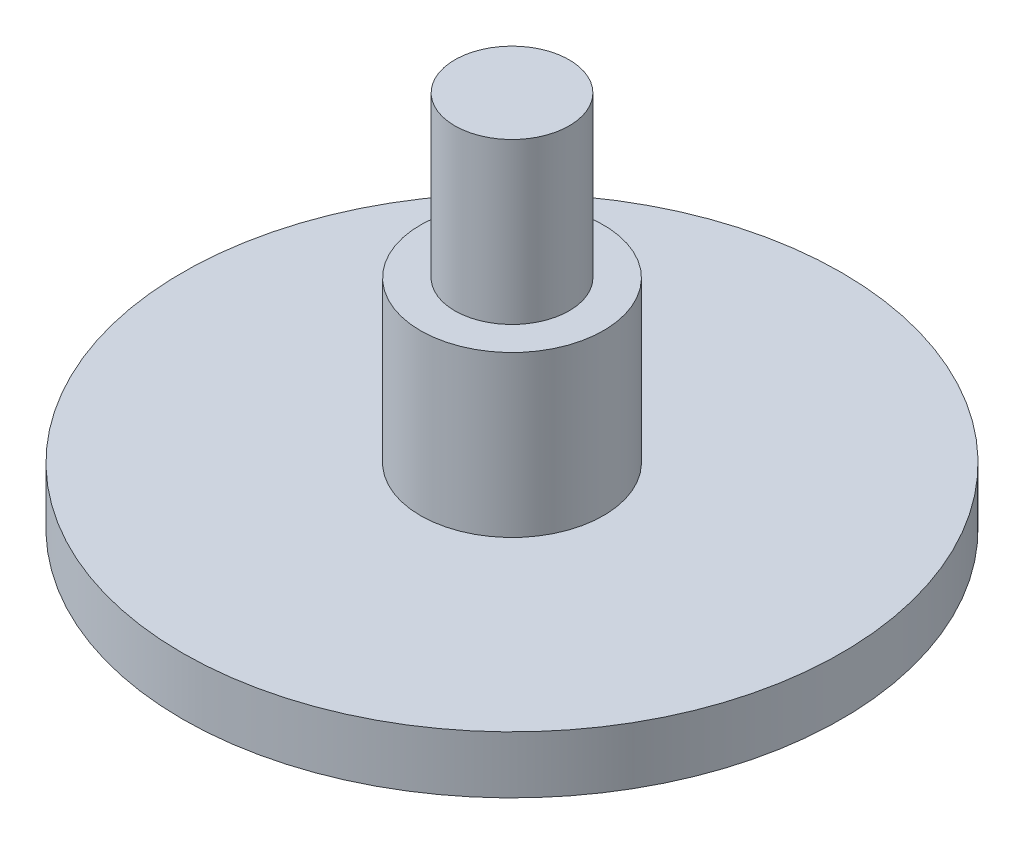
from build123d import *

# Parameters (mm, degrees)
SKETCH1_R           = 28.8
BOSS_EXTRUDE1_DEPTH = 5
SKETCH2_R           = 8
BOSS_EXTRUDE2_DEPTH = 14
SKETCH3_R           = 5
BOSS_EXTRUDE3_DEPTH = 14


with BuildPart() as part:
    # Sketch1 → Boss-Extrude1 (new body)
    with BuildSketch(Plane(origin=(0, 0, 0), x_dir=(1, 0, 0), z_dir=(0, 1, 0))):
        with Locations(Location((0, 0, 0), (0, 0, 270))):
            Circle(SKETCH1_R)
    extrude(amount=BOSS_EXTRUDE1_DEPTH)

    # Sketch2 → Boss-Extrude2 (add)
    with BuildSketch(Plane(origin=(0, 5, 0), x_dir=(1, 0, 0), z_dir=(0, 1, 0))):
        with Locations(Location((0, 0, 0), (0, 0, 270))):
            Circle(SKETCH2_R)
    extrude(amount=BOSS_EXTRUDE2_DEPTH)

    # Sketch3 → Boss-Extrude3 (add)
    with BuildSketch(Plane(origin=(0, 19, 0), x_dir=(1, 0, 0), z_dir=(0, 1, 0))):
        with Locations(Location((0, 0, 0), (0, 0, 270))):
            Circle(SKETCH3_R)
    extrude(amount=BOSS_EXTRUDE3_DEPTH)


solid = part.part
